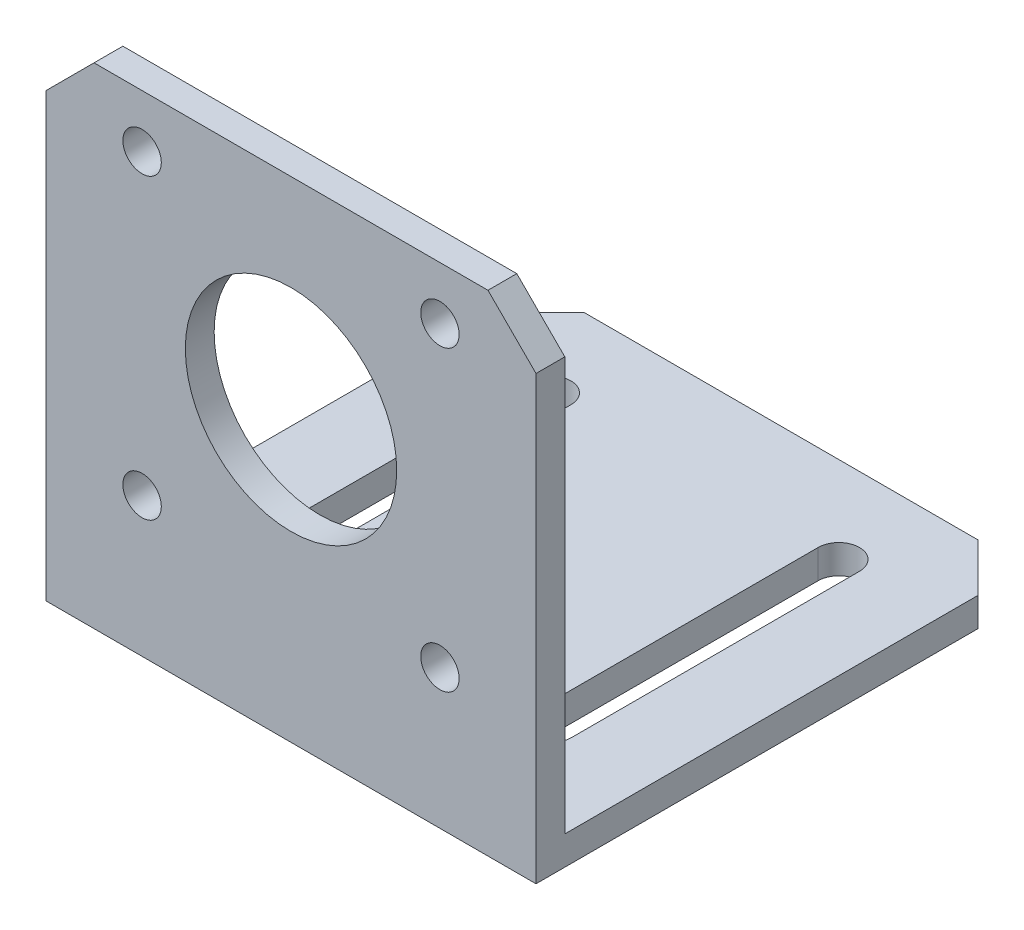
from build123d import *

# Parameters (mm, degrees)
IZIM1_W                     = 51
IZIM1_H                     = 51
Y_KSEKLIK_EKSTR_ZYON1_DEPTH = 51
IZIM2_W                     = 54.245036078
IZIM2_H                     = 53.426157313
KES_EKSTR_ZYON1_DEPTH       = 51
IZIM3_R                     = 11
IZIM3_R_2                   = 2
KES_EKSTR_ZYON2_DEPTH       = 51
PAH1_SIZE                   = 5
PAH2_SIZE                   = 5
KES_EKSTR_ZYON3_DEPTH       = 51


with BuildPart() as part:
    # Çizim1 → Yükseklik-Ekstrüzyon1 (new body)
    with BuildSketch(Plane.XY):
        Rectangle(IZIM1_W, IZIM1_H)
    extrude(amount=Y_KSEKLIK_EKSTR_ZYON1_DEPTH)

    # Çizim2 → Kes-Ekstrüzyon1 (cut)
    with BuildSketch(Plane.ZY.offset(25.5)):
        with Locations((20.877481961, 4.213078657)):
            Rectangle(IZIM2_W, IZIM2_H)
    extrude(amount=-KES_EKSTR_ZYON1_DEPTH, mode=Mode.SUBTRACT)

    # Çizim3 → Kes-Ekstrüzyon2 (cut)
    with BuildSketch(Plane.XY.offset(51)):
        with Locations((0, 4.5)):
            Circle(IZIM3_R)
        with Locations((-15.5, 20)):
            Circle(IZIM3_R_2)
        with Locations((15.5, 20)):
            Circle(IZIM3_R_2)
        with Locations((-15.5, -11)):
            Circle(IZIM3_R_2)
        with Locations((15.5, -11)):
            Circle(IZIM3_R_2)
    extrude(amount=-KES_EKSTR_ZYON2_DEPTH, mode=Mode.SUBTRACT)

    # Pah1
    pah1_edges = [part.edges().sort_by_distance(p)[0] for p in [
        (-25.5, 25.5, 49.5),
    ]]
    chamfer(pah1_edges, length=PAH1_SIZE)

    # Pah2
    pah2_edges = [part.edges().sort_by_distance(p)[0] for p in [
        (-25.5, -24, 0),
        (25.5, -24, 0),
        (25.5, 25.5, 49.5),
    ]]
    chamfer(pah2_edges, length=PAH2_SIZE)

    # Çizim4 → Kes-Ekstrüzyon3 (cut)
    with BuildSketch(Plane.XZ.offset(25.5)):
        with BuildLine():
            Line((-12.865, 39), (-12.865, 9))
            ThreePointArc((-12.865, 9), (-15.015, 6.85), (-17.165, 9))
            Line((-17.165, 9), (-17.165, 39))
            ThreePointArc((-17.165, 39), (-15.015, 41.15), (-12.865, 39))
        make_face()
        with BuildLine():
            Line((12.865, 39), (12.865, 9))
            ThreePointArc((12.865, 9), (15.015, 6.85), (17.165, 9))
            Line((17.165, 9), (17.165, 39))
            ThreePointArc((17.165, 39), (15.015, 41.15), (12.865, 39))
        make_face()
    extrude(amount=-KES_EKSTR_ZYON3_DEPTH, mode=Mode.SUBTRACT)


solid = part.part
